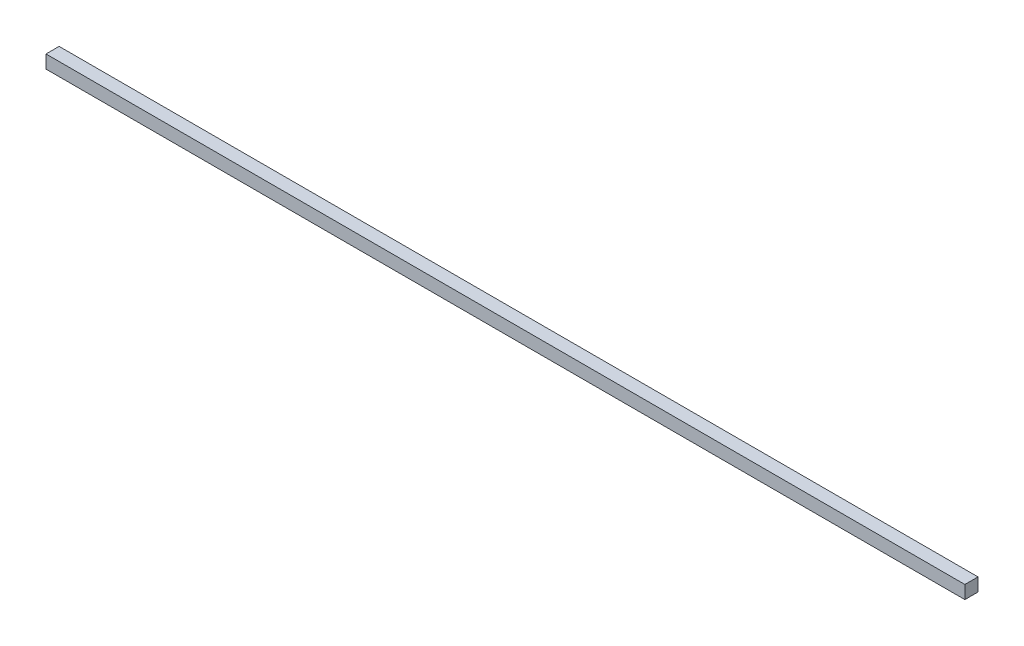
from build123d import *

# Parameters (mm, degrees)
SKETCH1_W           = 140
SKETCH1_H           = 2
BOSS_EXTRUDE1_DEPTH = 2


with BuildPart() as part:
    # Sketch1 → Boss-Extrude1 (new body)
    with BuildSketch(Plane(origin=(0, 0, 0), x_dir=(1, 0, 0), z_dir=(0, 1, 0))):
        Rectangle(SKETCH1_W, SKETCH1_H)
    extrude(amount=BOSS_EXTRUDE1_DEPTH)


solid = part.part
